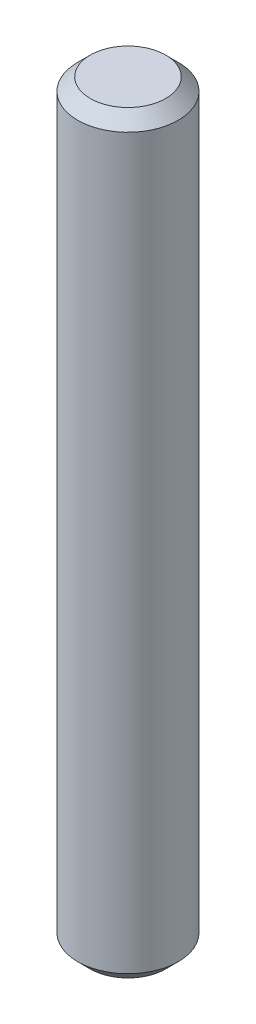
from build123d import *

# Parameters (mm, degrees)
SKETCH1_R           = 2
BOSS_EXTRUDE1_DEPTH = 30
CHAMFER1_SIZE       = 0.5


with BuildPart() as part:
    # Sketch1 → Boss-Extrude1 (new body)
    with BuildSketch(Plane(origin=(0, 0, 0), x_dir=(1, 0, 0), z_dir=(0, 1, 0))):
        with Locations(Location((0, 0, 0), (0, 0, 270))):
            Circle(SKETCH1_R)
    extrude(amount=BOSS_EXTRUDE1_DEPTH)

    # Chamfer1
    chamfer1_edges = [part.edges().sort_by_distance(p)[0] for p in [
        (0, 0, -2),
        (0, 30, -2),
    ]]
    chamfer(chamfer1_edges, length=CHAMFER1_SIZE)


solid = part.part
